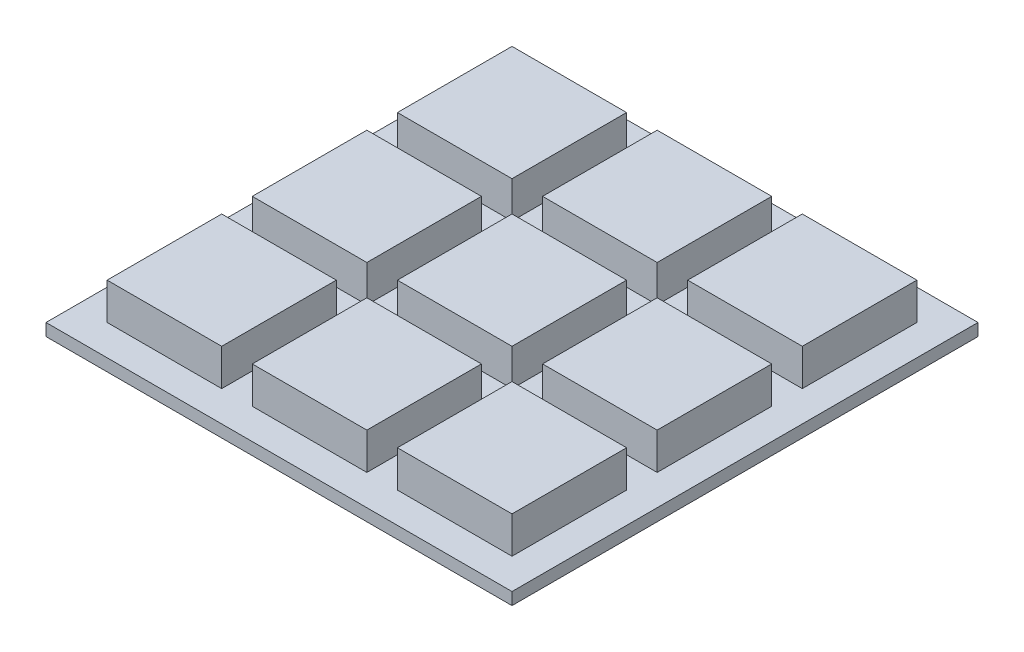
from build123d import *

# Parameters (mm, degrees)
SKETCH1_W           = 61
SKETCH1_H           = 61
BOSS_EXTRUDE1_DEPTH = 1.6
SKETCH2_W           = 15
SKETCH2_H           = 15
BOSS_EXTRUDE2_DEPTH = 4.8


with BuildPart() as part:
    # Sketch1 → Boss-Extrude1 (new body)
    with BuildSketch(Plane(origin=(0, 0, 0), x_dir=(1, 0, 0), z_dir=(0, 1, 0))):
        Rectangle(SKETCH1_W, SKETCH1_H)
    extrude(amount=BOSS_EXTRUDE1_DEPTH)

    # Sketch2 → Boss-Extrude2 (add)
    with BuildSketch(Plane(origin=(0, 1.6, 0), x_dir=(1, 0, 0), z_dir=(0, 1, 0))):
        with Locations((-19, 19)):
            Rectangle(SKETCH2_W, SKETCH2_H)
        with Locations((0, 19)):
            Rectangle(SKETCH2_W, SKETCH2_H)
        with Locations((19, 19)):
            Rectangle(SKETCH2_W, SKETCH2_H)
        with Locations((19, 0)):
            Rectangle(SKETCH2_W, SKETCH2_H)
        Rectangle(SKETCH2_W, SKETCH2_H)
        with Locations((-19, 0)):
            Rectangle(SKETCH2_W, SKETCH2_H)
        with Locations((-19, -19)):
            Rectangle(SKETCH2_W, SKETCH2_H)
        with Locations((0, -19)):
            Rectangle(SKETCH2_W, SKETCH2_H)
        with Locations((19, -19)):
            Rectangle(SKETCH2_W, SKETCH2_H)
    extrude(amount=BOSS_EXTRUDE2_DEPTH)


solid = part.part
